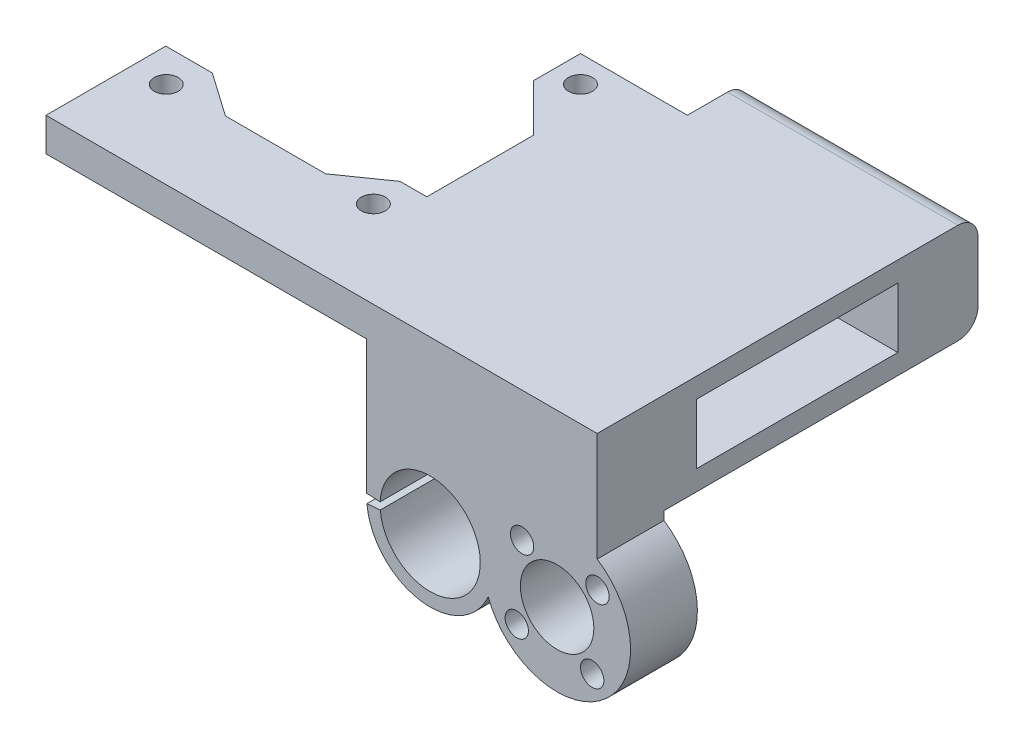
from build123d import *

# Parameters (mm, degrees)
SKETCH1_R               = 1.8
BOSS_EXTRUDE1_DEPTH     = 35
CUT_EXTRUDE1_DEPTH      = 20
FILLET1_R               = 3
CUT_EXTRUDE2_DEPTH      = 102.662431606
CUT_EXTRUDE2_DEPTH_BACK = 102.662431606
SKETCH5_W               = 48
SKETCH5_H               = 48
CUT_EXTRUDE3_DEPTH      = 30
SKETCH6_W               = 30.142
SKETCH6_H               = 9
CUT_EXTRUDE4_DEPTH      = 31.4
SKETCH7_W               = 21
SKETCH7_H               = 9
CUT_EXTRUDE5_DEPTH      = 85.173689476
SKETCH8_R               = 3.5
CUT_EXTRUDE6_DEPTH      = 1.5
SKETCH11_R              = 1.75
SKETCH11_R_2            = 5.5
BOSS_EXTRUDE3_DEPTH     = 10


with BuildPart() as part:
    # Sketch1 → Boss-Extrude1 (new body)
    with BuildSketch(Plane(origin=(0, 0, 0), x_dir=(1, 0, 0), z_dir=(0, 1, 0))):
        Polygon((6.964635103, 17.928932188), (0, 17.928932188), (0, 0), (82.5, 0), (82.5, 57), (48, 57), (48, 48), (32, 48), (32, 41), (39.071067812, 33.928932188), (39.071067812, 17.928932188), (35.071067812, 17.928932188), (28.517851458, 13.340320697), (13.517851458, 13.340320697), align=None)
        with Locations(Location((36, 44, 0), (0, 0, 270))):
            Circle(SKETCH1_R, mode=Mode.SUBTRACT)
        with Locations(Location((36, 13, 0), (0, 0, 270))):
            Circle(SKETCH1_R, mode=Mode.SUBTRACT)
        with Locations(Location((5, 13, 0), (0, 0, 270))):
            Circle(SKETCH1_R, mode=Mode.SUBTRACT)
    extrude(amount=BOSS_EXTRUDE1_DEPTH)

    # Sketch2 → Cut-Extrude1 (cut)
    with BuildSketch(Plane.XZ):
        Polygon((82.5, -57), (82.5, 0), (67, 0), (67, -48), (48, -48), (48, -57), align=None)
    extrude(amount=-CUT_EXTRUDE1_DEPTH, mode=Mode.SUBTRACT)

    # Fillet1
    fillet1_edges = [part.edges().sort_by_distance(p)[0] for p in [
        (65.25, 35, -57),
        (65.25, 20, -57),
    ]]
    fillet(fillet1_edges, radius=FILLET1_R)

    # Sketch3 → Cut-Extrude2 (cut, two sides: drawn at the far end of the back side and taken through both)
    with BuildSketch(Plane(origin=(0, 0, -48), x_dir=(-1, 0, 0), z_dir=(0, 0, -1)).offset(-CUT_EXTRUDE2_DEPTH_BACK)):
        with BuildLine():
            ThreePointArc((-50.010278489, 9.892519672), (-64.998857714, 9.630893048), (-50.028539764, 8.846331929))
            Line((-50.028539764, 8.846331929), (-48.036150368, 8.672020444))
            ThreePointArc((-48.036150368, 8.672020444), (-51.081893028, 2.4958653), (-57.5, 0))
            Line((-57.5, 0), (-48, 0))
            Line((-48, 0), (-48, 9.997873903))
            Line((-48, 9.997873903), (-50.010278489, 9.892519672))
        make_face()
        with BuildLine():
            Line((-67, 0), (-57.5, 0))
            ThreePointArc((-57.5, 0), (-64.217514421, 2.782485579), (-67, 9.5))
            Line((-67, 9.5), (-67, 0))
        make_face()
    extrude(amount=CUT_EXTRUDE2_DEPTH + CUT_EXTRUDE2_DEPTH_BACK, mode=Mode.SUBTRACT)

    # Sketch5 → Cut-Extrude3 (cut)
    with BuildSketch(Plane.XZ):
        with Locations((24, -24)):
            Rectangle(SKETCH5_W, SKETCH5_H)
    extrude(amount=-CUT_EXTRUDE3_DEPTH, mode=Mode.SUBTRACT)

    # Sketch6 → Cut-Extrude4 (cut)
    with BuildSketch(Plane(origin=(82.5, 0, 0), x_dir=(0, 0, -1), z_dir=(1, 0, 0))):
        with Locations((29.929, 27.5)):
            Rectangle(SKETCH6_W, SKETCH6_H)
    extrude(amount=-CUT_EXTRUDE4_DEPTH, mode=Mode.SUBTRACT)

    # Sketch7 → Cut-Extrude5 (cut, through all)
    with BuildSketch(Plane(origin=(51.1, 0, 0), x_dir=(0, 0, -1), z_dir=(1, 0, 0))):
        with Locations((28.428932188, 27.5)):
            Rectangle(SKETCH7_W, SKETCH7_H)
    extrude(amount=-CUT_EXTRUDE5_DEPTH, mode=Mode.SUBTRACT)

    # Sketch8 → Cut-Extrude6 (cut)
    with BuildSketch(Plane.XZ.offset(-30)):
        with Locations(Location((5, -13, 0), (0, 0, 270))):
            Circle(SKETCH8_R)
        with Locations(Location((36, -13, 0), (0, 0, 270))):
            Circle(SKETCH8_R)
        with Locations(Location((36, -44, 0), (0, 0, 270))):
            Circle(SKETCH8_R)
    extrude(amount=-CUT_EXTRUDE6_DEPTH, mode=Mode.SUBTRACT)

    # Sketch11 → Boss-Extrude3 (add)
    with BuildSketch(Plane.XY):
        with BuildLine():
            Line((67, 20), (67, 9.5))
            ThreePointArc((67, 9.5), (66.795496221, 7.539451607), (66.190789474, 5.663311542))
            ThreePointArc((66.190789474, 5.663311542), (83.374491132, 0.912720357), (82.5, 18.719544457))
            Line((82.5, 18.719544457), (82.5, 20))
            Line((82.5, 20), (67, 20))
        make_face()
        with Locations((82.537676642, 14.748472232)):
            Circle(SKETCH11_R, mode=Mode.SUBTRACT)
        with Locations((70.462323358, 4.251527768)):
            Circle(SKETCH11_R, mode=Mode.SUBTRACT)
        with Locations((81.748472232, 3.462323358)):
            Circle(SKETCH11_R, mode=Mode.SUBTRACT)
        with Locations((76.5, 9.5)):
            Circle(SKETCH11_R_2, mode=Mode.SUBTRACT)
        with Locations((71.251527768, 15.537676642)):
            Circle(SKETCH11_R, mode=Mode.SUBTRACT)
    extrude(amount=-BOSS_EXTRUDE3_DEPTH)


solid = part.part
